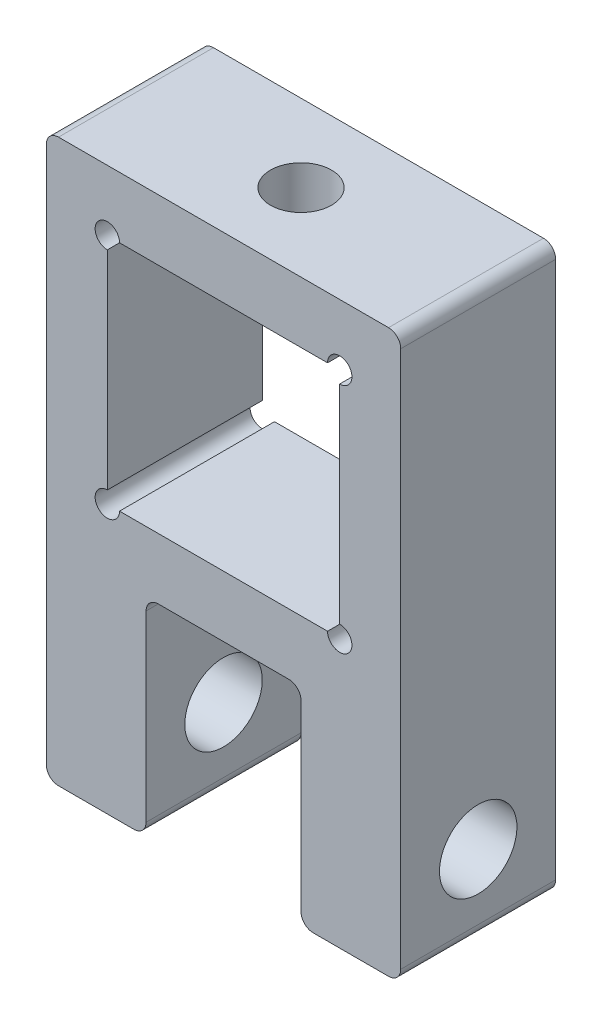
from build123d import *

# Parameters (mm, degrees)
BOSS_EXTRU_1_DEPTH           = 12.7
ENL_V_MAT_EXTRU_1_DEPTH      = 53.131162705
ENL_V_MAT_EXTRU_1_DEPTH_BACK = 53.131162705
ESQUISSE2_R                  = 3.175
CONG_2_R                     = 1
ENL_V_MAT_EXTRU_2_REACH      = 51.929
ESQUISSE3_R                  = 2.5


with BuildPart() as part:
    # Esquisse1 → Boss.-Extru.1 (new body)
    with BuildSketch(Plane.XY):
        with BuildLine():
            Line((0, 41.05), (0, 46.05))
            Line((0, 46.05), (-14.525, 46.05))
            Line((-14.525, 46.05), (-14.525, 0))
            Line((-14.525, 0), (-6.35, 0))
            Line((-6.35, 0), (-6.35, 17))
            Line((-6.35, 17), (0, 17))
            Line((0, 17), (0, 22))
            Line((0, 22), (-8.525, 22))
            ThreePointArc((-8.525, 22), (-10.232106781, 21.292893219), (-9.525, 23))
            Line((-9.525, 23), (-9.525, 40.05))
            ThreePointArc((-9.525, 40.05), (-10.232106781, 41.757106781), (-8.525, 41.05))
            Line((-8.525, 41.05), (0, 41.05))
        make_face()
        with BuildLine():
            Line((14.525, 0), (14.525, 46.05))
            Line((14.525, 46.05), (0, 46.05))
            Line((0, 46.05), (0, 41.05))
            Line((0, 41.05), (8.525, 41.05))
            ThreePointArc((8.525, 41.05), (9.525, 42.05), (10.525, 41.05))
            ThreePointArc((10.525, 41.05), (10.232106781, 40.342893219), (9.525, 40.05))
            Line((9.525, 40.05), (9.525, 23))
            ThreePointArc((9.525, 23), (10.232106781, 22.707106781), (10.525, 22))
            ThreePointArc((10.525, 22), (9.525, 21), (8.525, 22))
            Line((8.525, 22), (0, 22))
            Line((0, 22), (0, 17))
            Line((0, 17), (6.35, 17))
            Line((6.35, 17), (6.35, 0))
            Line((6.35, 0), (14.525, 0))
        make_face()
    extrude(amount=BOSS_EXTRU_1_DEPTH)

    # Esquisse2 → Enlèv. mat.-Extru.1 (cut, two sides: drawn at the far end of the back side and taken through both)
    with BuildSketch(Plane(origin=(-6.35, 0, 0), x_dir=(0, 0, -1), z_dir=(1, 0, 0)).offset(-ENL_V_MAT_EXTRU_1_DEPTH_BACK)):
        with Locations(Location((-6.35, 6.35, 0), (0, 0, 90))):
            Circle(ESQUISSE2_R)
    extrude(amount=ENL_V_MAT_EXTRU_1_DEPTH + ENL_V_MAT_EXTRU_1_DEPTH_BACK, mode=Mode.SUBTRACT)

    # Congé2
    cong_2_edges = [part.edges().sort_by_distance(p)[0] for p in [
        (14.525, 0, 6.35),
        (6.35, 0, 6.35),
        (6.35, 17, 6.35),
        (-6.35, 17, 6.35),
        (-6.35, 0, 6.35),
        (-14.525, 0, 6.35),
        (-14.525, 46.05, 6.35),
        (14.525, 46.05, 6.35),
    ]]
    fillet(cong_2_edges, radius=CONG_2_R)

    # Esquisse3 → Enlèv. mat.-Extru.2 (cut, up to next)
    with BuildSketch(Plane(origin=(0, 46.05, 0), x_dir=(1, 0, 0), z_dir=(0, 1, 0)), mode=Mode.PRIVATE) as enl_v_mat_extru_2_sk1:
        with Locations(Location((0, -6.35, 0), (0, 0, 270))):
            Circle(ESQUISSE3_R)
    enl_v_mat_extru_2_tool1 = extrude(enl_v_mat_extru_2_sk1.sketch, amount=-ENL_V_MAT_EXTRU_2_REACH, mode=Mode.PRIVATE) & part.part
    add(enl_v_mat_extru_2_tool1.solids().sort_by_distance((0, 46.05, 6.35))[0], mode=Mode.SUBTRACT)


solid = part.part
